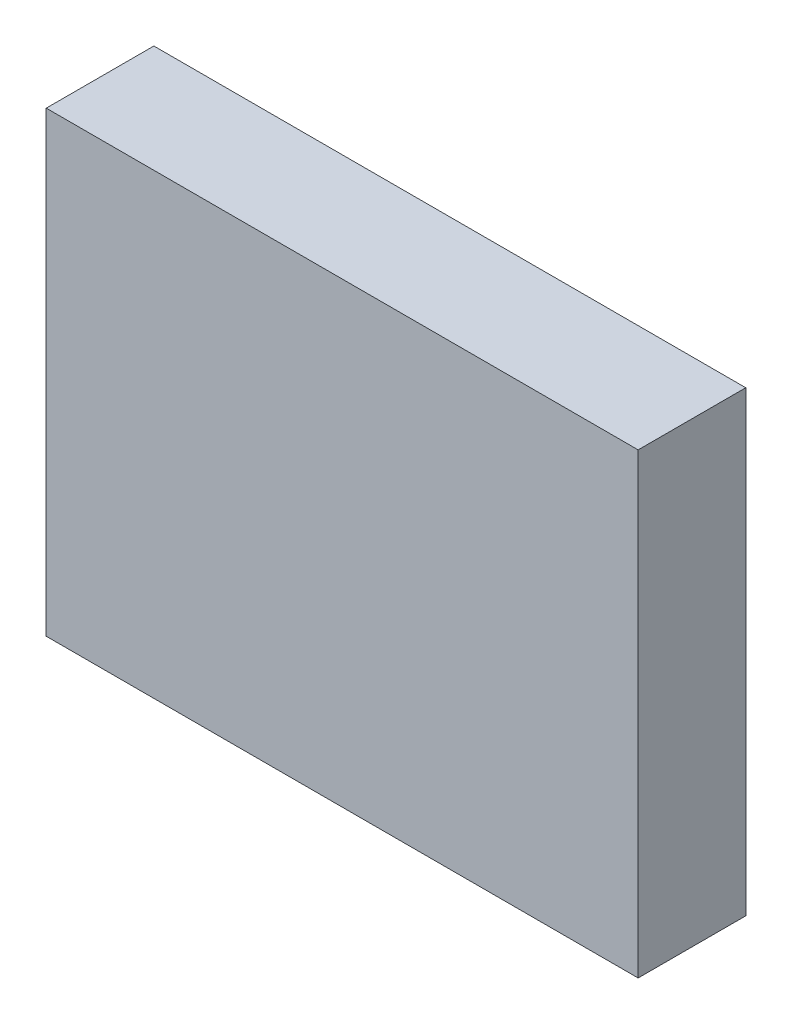
from build123d import *

# Parameters (mm, degrees)
SKETCH1_W           = 22
SKETCH1_H           = 17
BOSS_EXTRUDE1_DEPTH = 4


with BuildPart() as part:
    # Sketch1 → Boss-Extrude1 (new body)
    with BuildSketch(Plane.XY):
        with Locations((11, 8.5)):
            Rectangle(SKETCH1_W, SKETCH1_H)
    extrude(amount=BOSS_EXTRUDE1_DEPTH)


solid = part.part
